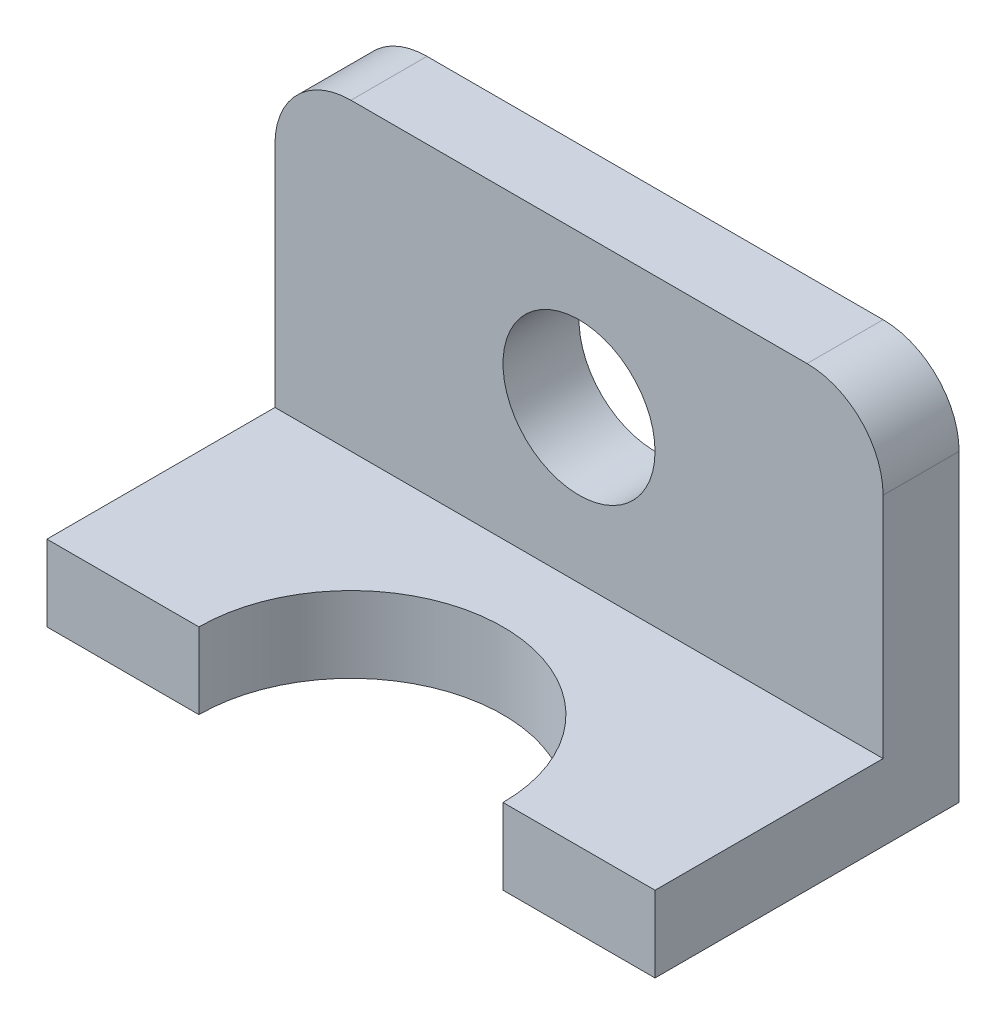
from build123d import *

# Parameters (mm, degrees)
SKETCH1_W                    = 50.8
SKETCH1_H                    = 63.5
BOSS_EXTRUDE1_DEPTH          = 50.8
CUT_EXTRUDE1_DEPTH           = 96.882897328
CUT_EXTRUDE1_DEPTH_BACK      = 96.882897328
SKETCH2_W                    = 38.1
SKETCH2_H                    = 50.8
FILLET1_R                    = 12.7
CUT_EXTRUDE2_DEPTH           = 88.988181024
CUT_EXTRUDE2_DEPTH_BACK      = 88.988181024
SKETCH3_R                    = 25.4
F_97_0_0059_DIAMETER_HOLE1_D = 25.4


with BuildPart() as part:
    # Sketch1 → Boss-Extrude1 (new, symmetric)
    with BuildSketch(Plane(origin=(0, 0, 0), x_dir=(0, 0, -1), z_dir=(1, 0, 0))):
        with Locations((25.4, 31.75)):
            Rectangle(SKETCH1_W, SKETCH1_H)
    extrude(amount=BOSS_EXTRUDE1_DEPTH, both=True)

    # Sketch2 → Cut-Extrude1 (cut, two sides: drawn at the far end of the back side and taken through both)
    with BuildSketch(Plane(origin=(0, 0, 0), x_dir=(0, 0, -1), z_dir=(1, 0, 0)).offset(-CUT_EXTRUDE1_DEPTH_BACK)):
        with Locations((19.05, 38.1)):
            Rectangle(SKETCH2_W, SKETCH2_H)
    extrude(amount=CUT_EXTRUDE1_DEPTH + CUT_EXTRUDE1_DEPTH_BACK, mode=Mode.SUBTRACT)

    # Fillet1
    fillet1_edges = [part.edges().sort_by_distance(p)[0] for p in [
        (50.8, 63.5, -44.45),
        (-50.8, 63.5, -44.45),
    ]]
    fillet(fillet1_edges, radius=FILLET1_R)

    # Sketch3 → Cut-Extrude2 (cut, two sides: drawn at the far end of the back side and taken through both)
    with BuildSketch(Plane(origin=(0, 12.7, 0), x_dir=(1, 0, 0), z_dir=(0, 1, 0)).offset(-CUT_EXTRUDE2_DEPTH_BACK)):
        Circle(SKETCH3_R)
    extrude(amount=CUT_EXTRUDE2_DEPTH + CUT_EXTRUDE2_DEPTH_BACK, mode=Mode.SUBTRACT)

    # #97 (0.0059) Diameter Hole1 (through all)
    with Locations(Plane.XY.offset(-38.1)):
        with Locations((0, 38.1)):
            Hole(F_97_0_0059_DIAMETER_HOLE1_D / 2)


solid = part.part
